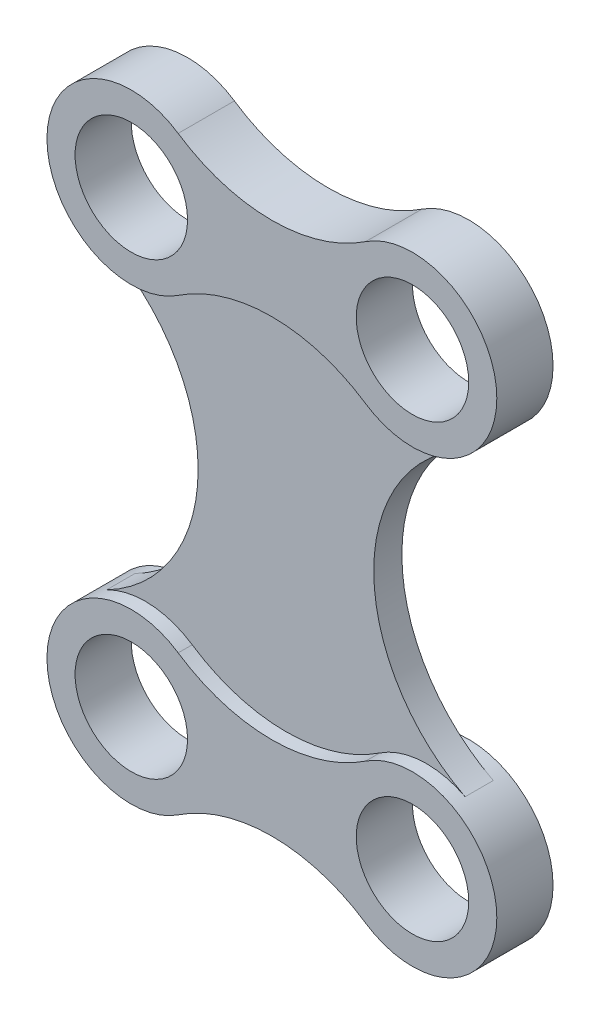
from build123d import *

# Parameters (mm, degrees)
SKETCH1_R             = 10
BOSS_EXTRUDE1_DEPTH   = 5
BOSS_EXTRUDE1_2_DEPTH = 5
BOSS_EXTRUDE2_DEPTH   = 2.5


with BuildPart() as part:
    # Sketch1 → Boss-Extrude1 (new, symmetric)
    with BuildSketch(Plane.XY):
        with BuildLine():
            ThreePointArc((-16.666666667, 27.527808711), (0, 32.583426132), (16.666666667, 27.527808711))
            ThreePointArc((16.666666667, 27.527808711), (40, 40), (16.666666667, 52.472191289))
            ThreePointArc((16.666666667, 52.472191289), (0, 47.416573868), (-16.666666667, 52.472191289))
            ThreePointArc((-16.666666667, 52.472191289), (-40, 40), (-16.666666667, 27.527808711))
        make_face()
        with Locations((-25, 40)):
            Circle(SKETCH1_R, mode=Mode.SUBTRACT)
        with Locations((25, 40)):
            Circle(SKETCH1_R, mode=Mode.SUBTRACT)
    extrude(amount=BOSS_EXTRUDE1_DEPTH, both=True)



with BuildPart() as body_2:
    # Sketch1 → Boss-Extrude1 2 (new, symmetric)
    with BuildSketch(Plane.XY):
        with BuildLine():
            ThreePointArc((16.666666667, -52.472191289), (40, -40), (16.666666667, -27.527808711))
            ThreePointArc((16.666666667, -27.527808711), (0, -32.583426132), (-16.666666667, -27.527808711))
            ThreePointArc((-16.666666667, -27.527808711), (-40, -40), (-16.666666667, -52.472191289))
            ThreePointArc((-16.666666667, -52.472191289), (0, -47.416573868), (16.666666667, -52.472191289))
        make_face()
        with Locations((-25, -40)):
            Circle(SKETCH1_R, mode=Mode.SUBTRACT)
        with Locations((25, -40)):
            Circle(SKETCH1_R, mode=Mode.SUBTRACT)
    extrude(amount=BOSS_EXTRUDE1_2_DEPTH, both=True)


with BuildPart() as part_1:
    add(part.part)

    add(body_2.part)  # Boss-Extrude2 merges body 2
    # Sketch1<3> → Boss-Extrude2 (add, symmetric)
    with BuildSketch(Plane.XY):
        with BuildLine():
            ThreePointArc((31.871842709, 26.666666667), (24.151837211, 25.023998535), (16.666666667, 27.527808711))
            ThreePointArc((16.666666667, 27.527808711), (0, 32.583426132), (-16.666666667, 27.527808711))
            ThreePointArc((-16.666666667, 27.527808711), (-24.151837211, 25.023998535), (-31.871842709, 26.666666667))
            ThreePointArc((-31.871842709, 26.666666667), (-15.615528128, 0), (-31.871842709, -26.666666667))
            ThreePointArc((-31.871842709, -26.666666667), (-24.151837211, -25.023998535), (-16.666666667, -27.527808711))
            ThreePointArc((-16.666666667, -27.527808711), (0, -32.583426132), (16.666666667, -27.527808711))
            ThreePointArc((16.666666667, -27.527808711), (24.151837211, -25.023998535), (31.871842709, -26.666666667))
            ThreePointArc((31.871842709, -26.666666667), (15.615528128, 0), (31.871842709, 26.666666667))
        make_face()
    extrude(amount=BOSS_EXTRUDE2_DEPTH, both=True)


solid = part_1.part
